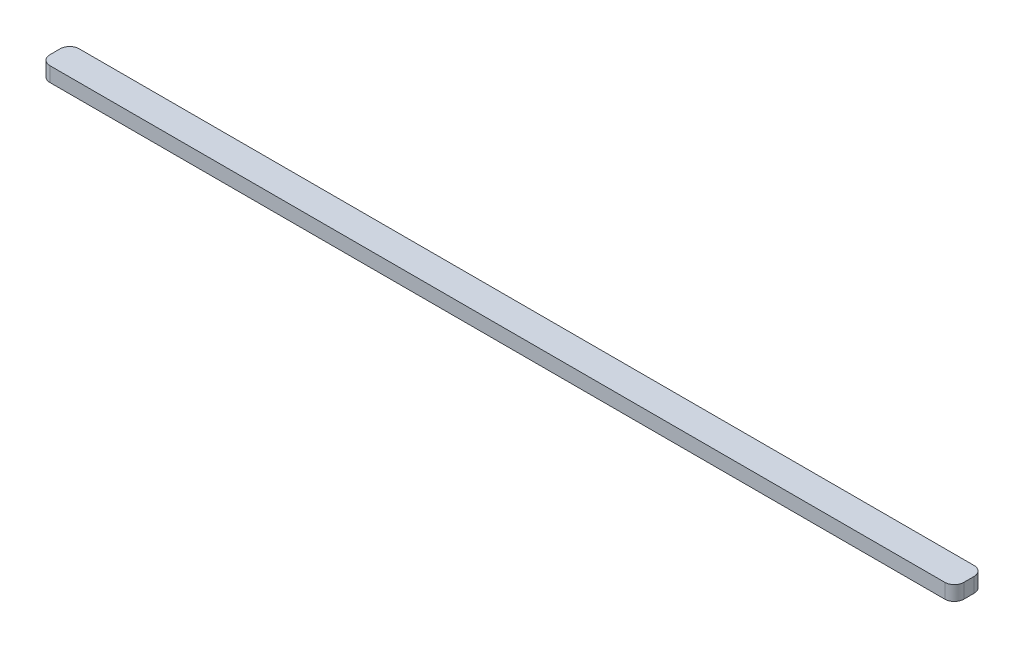
from build123d import *

# Parameters (mm, degrees)
SALIENTE_EXTRUIR1_DEPTH = 2


with BuildPart() as part:
    # Croquis1 → Saliente-Extruir1 (new body)
    with BuildSketch(Plane(origin=(0, 0, 0), x_dir=(1, 0, 0), z_dir=(0, 1, 0))):
        with BuildLine():
            Line((-61.2, 0), (61.2, 0))
            ThreePointArc((61.2, 0), (62.119238816, 0.380761184), (62.5, 1.3))
            Line((62.5, 1.3), (62.5, 2.7))
            ThreePointArc((62.5, 2.7), (62.119238816, 3.619238816), (61.2, 4))
            Line((61.2, 4), (-61.2, 4))
            ThreePointArc((-61.2, 4), (-62.119238816, 3.619238816), (-62.5, 2.7))
            Line((-62.5, 2.7), (-62.5, 1.3))
            ThreePointArc((-62.5, 1.3), (-62.119238816, 0.380761184), (-61.2, 0))
        make_face()
    extrude(amount=SALIENTE_EXTRUIR1_DEPTH)


solid = part.part
